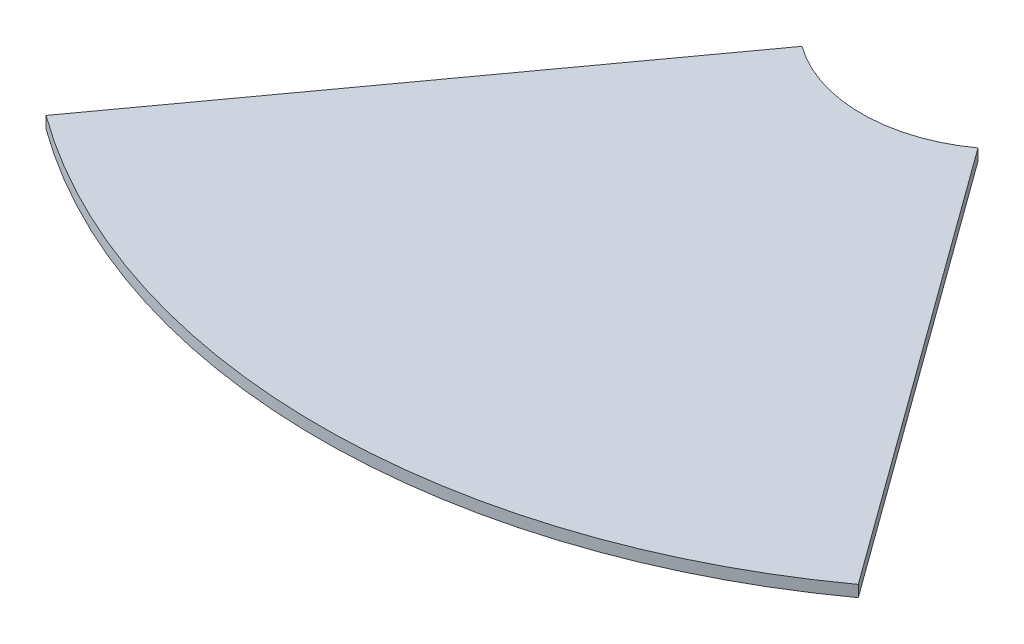
from build123d import *

# Parameters (mm, degrees)
BOSS_EXTRUDE1_DEPTH = 5


with BuildPart() as part:
    # Sketch1 → Boss-Extrude1 (new body)
    with BuildSketch(Plane(origin=(0, 0, 0), x_dir=(1, 0, 0), z_dir=(0, 1, 0))):
        with BuildLine():
            Line((38.206041399, -52.586104634), (176.335575688, -242.705098312))
            ThreePointArc((176.335575688, -242.705098312), (0, -300), (-176.335575688, -242.705098312))
            Line((-176.335575688, -242.705098312), (-38.206041399, -52.586104634))
            ThreePointArc((-38.206041399, -52.586104634), (0, -65), (38.206041399, -52.586104634))
        make_face()
    extrude(amount=BOSS_EXTRUDE1_DEPTH)


solid = part.part
